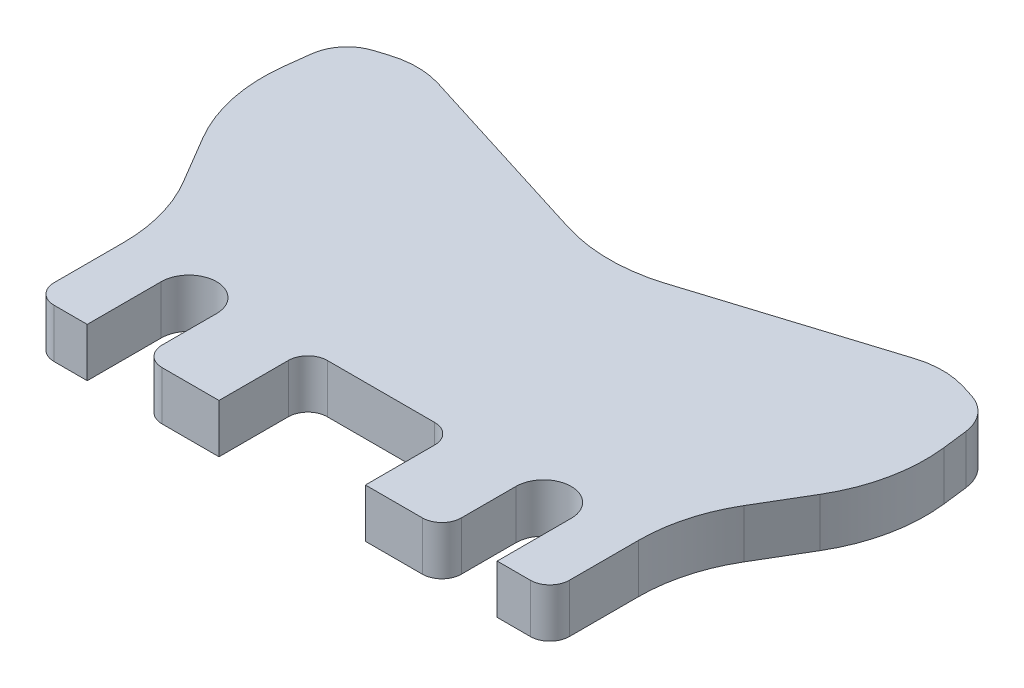
from build123d import *

# Parameters (mm, degrees)
BOSS_EXTRUDE1_DEPTH = 3
FILLET1_R           = 1.2
FILLET2_R           = 5
FILLET3_R           = 10
FILLET4_R           = 2.5


with BuildPart() as part:
    # Sketch1 → Boss-Extrude1 (new body)
    with BuildSketch(Plane(origin=(0, 0, 0), x_dir=(1, 0, 0), z_dir=(0, 1, 0))):
        with BuildLine():
            Line((-4.5, 0), (4.5, 0))
            Line((4.5, 0), (4.5, -5.46))
            Line((4.5, -5.46), (9.2, -5.46))
            Line((9.2, -5.46), (9.2, -0.91))
            ThreePointArc((9.2, -0.91), (10.9, 0.79), (12.6, -0.91))
            Line((12.6, -0.91), (12.6, -5.46))
            Line((12.6, -5.46), (15.84, -5.46))
            Line((15.84, -5.46), (15.84, 2.73))
            Line((15.84, 2.73), (20.705, 10.95))
            Line((20.705, 10.95), (19.91, 17.44))
            Line((19.91, 17.44), (16.145, 18.62))
            Line((16.145, 18.62), (0, 13.56))
            Line((0, 13.56), (-16.145, 18.62))
            Line((-16.145, 18.62), (-19.91, 17.44))
            Line((-19.91, 17.44), (-20.705, 10.95))
            Line((-20.705, 10.95), (-15.84, 2.73))
            Line((-15.84, 2.73), (-15.84, -5.46))
            Line((-15.84, -5.46), (-12.6, -5.46))
            Line((-12.6, -5.46), (-12.6, -0.91))
            ThreePointArc((-12.6, -0.91), (-10.9, 0.79), (-9.2, -0.91))
            Line((-9.2, -0.91), (-9.2, -5.46))
            Line((-9.2, -5.46), (-4.5, -5.46))
            Line((-4.5, -5.46), (-4.5, 0))
        make_face()
    extrude(amount=BOSS_EXTRUDE1_DEPTH)

    # Fillet1
    fillet1_edges = [part.edges().sort_by_distance(p)[0] for p in [
        (4.5, 1.5, 0),
        (-4.5, 1.5, 0),
        (-9.2, 1.5, 5.46),
        (-15.84, 1.5, 5.46),
        (15.84, 1.5, 5.46),
        (9.2, 1.5, 5.46),
    ]]
    fillet(fillet1_edges, radius=FILLET1_R)

    # Fillet2
    fillet2_edges = [part.edges().sort_by_distance(p)[0] for p in [
        (-16.145, 1.5, -18.62),
        (16.145, 1.5, -18.62),
    ]]
    fillet(fillet2_edges, radius=FILLET2_R)

    # Fillet3
    fillet3_edges = [part.edges().sort_by_distance(p)[0] for p in [
        (-15.84, 1.5, -2.73),
        (-20.705, 1.5, -10.95),
        (0, 1.5, -13.56),
        (20.705, 1.5, -10.95),
        (15.84, 1.5, -2.73),
    ]]
    fillet(fillet3_edges, radius=FILLET3_R)

    # Fillet4
    fillet4_edges = [part.edges().sort_by_distance(p)[0] for p in [
        (-19.91, 1.5, -17.44),
        (19.91, 1.5, -17.44),
    ]]
    fillet(fillet4_edges, radius=FILLET4_R)


solid = part.part
